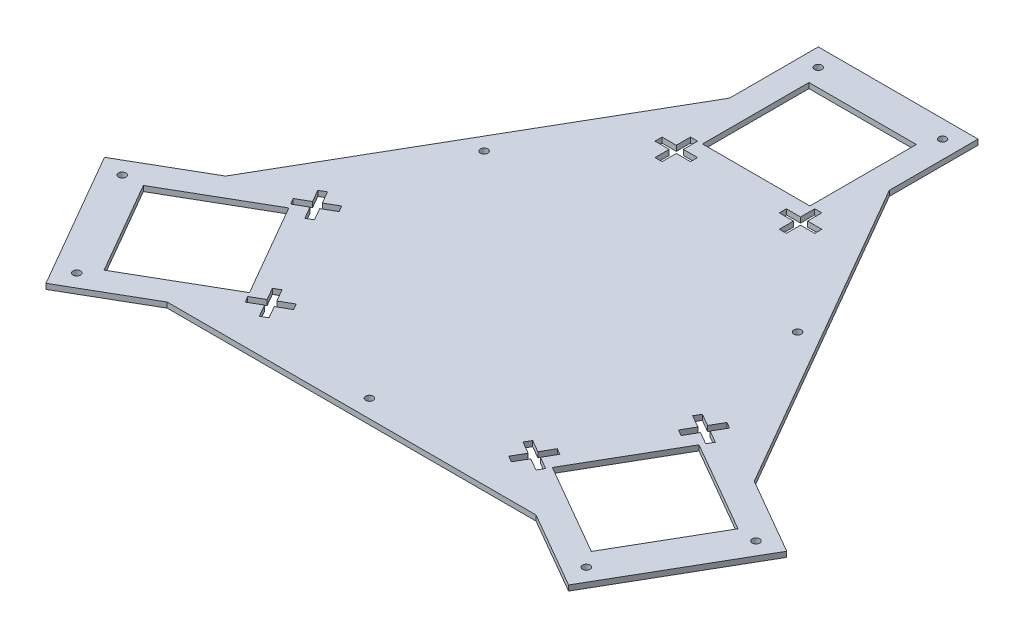
from build123d import *

# Parameters (mm, degrees)
ESQUISSE1_W             = 60.5
ESQUISSE1_H             = 60
BOSS_EXTRU_1_DEPTH      = 3
ESQUISSE2_R             = 2.1
ENL_V_MAT_EXTRU_1_DEPTH = 275.531688146
ESQUISSE6_W             = 4
ESQUISSE6_H             = 8
ENL_V_MAT_EXTRU_2_DEPTH = 275.531688146


with BuildPart() as part:
    # Esquisse1 → Boss.-Extru.1 (new body)
    with BuildSketch(Plane(origin=(0, 0, 0), x_dir=(1, 0, 0), z_dir=(0, 1, 0))):
        Polygon((-147.224318643, -136.961524227), (-103.923048454, -111.961524227), (103.923048454, -111.961524227), (147.224318643, -136.961524227), (192.224318643, -59.019237886), (148.923048454, -34.019237886), (45, 145.980762114), (45, 195.980762114), (-45, 195.980762114), (-45, 145.980762114), (-148.923048454, -34.019237886), (-192.224318643, -59.019237886), align=None)
        Polygon((-137.278810568, -114.187649521), (-167.528810568, -61.793112592), (-115.567286341, -31.793112592), (-85.317286341, -84.187649521), align=None, mode=Mode.SUBTRACT)
        Polygon((167.528810568, -61.793112592), (137.278810568, -114.187649521), (85.317286341, -84.187649521), (115.567286341, -31.793112592), align=None, mode=Mode.SUBTRACT)
        with Locations((0, 145.980762114)):
            Rectangle(ESQUISSE1_W, ESQUISSE1_H, mode=Mode.SUBTRACT)
    extrude(amount=BOSS_EXTRU_1_DEPTH)

    # Esquisse2 → Enlèv. mat.-Extru.1 (cut, through all)
    with BuildSketch(Plane(origin=(0, 3, 0), x_dir=(1, 0, 0), z_dir=(0, 1, 0))):
        with Locations(Location((-35, 185.980762114, 0), (0, 0, 270))):
            Circle(ESQUISSE2_R)
        with Locations(Location((35, 185.980762114, 0), (0, 0, 90))):
            Circle(ESQUISSE2_R)
        with Locations(Location((-143.564064605, -123.301270189, 0), (0, 0, 270))):
            Circle(ESQUISSE2_R)
        with Locations(Location((-178.564064605, -62.679491924, 0), (0, 0, 90))):
            Circle(ESQUISSE2_R)
        with Locations(Location((178.564064606, -62.679491924, 0), (0, 0, 270))):
            Circle(ESQUISSE2_R)
        with Locations(Location((143.564064606, -123.301270189, 0), (0, 0, 90))):
            Circle(ESQUISSE2_R)
        with Locations(Location((88.301270189, 50.980762114, 0), (0, 0, 270))):
            Circle(ESQUISSE2_R)
        with Locations(Location((0, -101.961524227, 0), (0, 0, 270))):
            Circle(ESQUISSE2_R)
        with Locations(Location((-88.301270189, 50.980762114, 0), (0, 0, 270))):
            Circle(ESQUISSE2_R)
    extrude(amount=-ENL_V_MAT_EXTRU_1_DEPTH, mode=Mode.SUBTRACT)

    # Esquisse6 → Enlèv. mat.-Extru.2 (cut, through all)
    with BuildSketch(Plane(origin=(0, 3, 0), x_dir=(1, 0, 0), z_dir=(0, 1, 0))):
        with Locations((-35, 111.980762114)):
            Rectangle(ESQUISSE6_W, ESQUISSE6_H)
        Polygon((-37, 105.980762114), (-37, 103.980762114), (-33, 103.980762114), (-33, 105.980762114), (-33, 107.980762114), (-37, 107.980762114), align=None)
        Polygon((-45, 107.980762114), (-45, 103.980762114), (-37, 103.980762114), (-37, 105.980762114), (-37, 107.980762114), align=None)
        Polygon((-33, 105.980762114), (-33, 103.980762114), (-25, 103.980762114), (-25, 107.980762114), (-33, 107.980762114), align=None)
        with Locations((-35, 99.980762114)):
            Rectangle(ESQUISSE6_W, ESQUISSE6_H)
        Polygon((33, 105.980762114), (33, 107.980762114), (25, 107.980762114), (25, 103.980762114), (33, 103.980762114), align=None)
        with Locations((35, 111.980762114)):
            Rectangle(ESQUISSE6_W, ESQUISSE6_H)
        Polygon((37, 105.980762114), (37, 107.980762114), (33, 107.980762114), (33, 105.980762114), (33, 103.980762114), (37, 103.980762114), align=None)
        Polygon((45, 103.980762114), (45, 107.980762114), (37, 107.980762114), (37, 105.980762114), (37, 103.980762114), align=None)
        with Locations((35, 99.980762114)):
            Rectangle(ESQUISSE6_W, ESQUISSE6_H)
        Polygon((116.01408311, -15.019237886), (112.549981495, -13.019237886), (108.549981495, -19.947441117), (110.282032303, -20.947441117), (112.01408311, -21.947441117), align=None)
        Polygon((110.282032303, -20.947441117), (108.549981495, -19.947441117), (106.549981495, -23.411542732), (108.282032303, -24.411542732), (110.01408311, -25.411542732), (112.01408311, -21.947441117), align=None)
        Polygon((108.549981495, -19.947441117), (101.621778265, -15.947441117), (99.621778265, -19.411542732), (106.549981495, -23.411542732), align=None)
        Polygon((108.282032303, -24.411542732), (106.549981495, -23.411542732), (102.549981495, -30.339745962), (106.01408311, -32.339745962), (110.01408311, -25.411542732), align=None)
        Polygon((118.942286341, -25.947441117), (112.01408311, -21.947441117), (110.01408311, -25.411542732), (116.942286341, -29.411542732), align=None)
        Polygon((64.621778265, -80.033320997), (71.549981495, -84.033320997), (73.549981495, -80.569219382), (66.621778265, -76.569219382), align=None)
        Polygon((75.282032303, -81.569219382), (77.01408311, -82.569219382), (81.01408311, -75.641016151), (77.549981495, -73.641016151), (73.549981495, -80.569219382), align=None)
        Polygon((73.282032303, -85.033320997), (75.01408311, -86.033320997), (77.01408311, -82.569219382), (75.282032303, -81.569219382), (73.549981495, -80.569219382), (71.549981495, -84.033320997), align=None)
        Polygon((77.01408311, -82.569219382), (75.01408311, -86.033320997), (81.942286341, -90.033320997), (83.942286341, -86.569219382), align=None)
        Polygon((67.549981495, -90.961524227), (71.01408311, -92.961524227), (75.01408311, -86.033320997), (73.282032303, -85.033320997), (71.549981495, -84.033320997), align=None)
        Polygon((-75.282032303, -81.569219382), (-73.549981495, -80.569219382), (-77.549981495, -73.641016151), (-81.01408311, -75.641016151), (-77.01408311, -82.569219382), align=None)
        Polygon((-81.942286341, -90.033320997), (-75.01408311, -86.033320997), (-77.01408311, -82.569219382), (-83.942286341, -86.569219382), align=None)
        Polygon((-71.01408311, -92.961524227), (-67.549981495, -90.961524227), (-71.549981495, -84.033320997), (-73.282032303, -85.033320997), (-75.01408311, -86.033320997), align=None)
        Polygon((-71.549981495, -84.033320997), (-64.621778265, -80.033320997), (-66.621778265, -76.569219382), (-73.549981495, -80.569219382), align=None)
        Polygon((-110.01408311, -25.411542732), (-112.01408311, -21.947441117), (-118.942286341, -25.947441117), (-116.942286341, -29.411542732), align=None)
        Polygon((-112.549981495, -13.019237886), (-116.01408311, -15.019237886), (-112.01408311, -21.947441117), (-110.282032303, -20.947441117), (-108.549981495, -19.947441117), align=None)
        Polygon((-110.282032303, -20.947441117), (-112.01408311, -21.947441117), (-110.01408311, -25.411542732), (-108.282032303, -24.411542732), (-106.549981495, -23.411542732), (-108.549981495, -19.947441117), align=None)
        Polygon((-101.621778265, -15.947441117), (-108.549981495, -19.947441117), (-106.549981495, -23.411542732), (-99.621778265, -19.411542732), align=None)
        Polygon((-108.282032303, -24.411542732), (-110.01408311, -25.411542732), (-106.01408311, -32.339745962), (-102.549981495, -30.339745962), (-106.549981495, -23.411542732), align=None)
        Polygon((-73.282032303, -85.033320997), (-71.549981495, -84.033320997), (-73.549981495, -80.569219382), (-75.282032303, -81.569219382), (-77.01408311, -82.569219382), (-75.01408311, -86.033320997), align=None)
    extrude(amount=-ENL_V_MAT_EXTRU_2_DEPTH, mode=Mode.SUBTRACT)


solid = part.part
